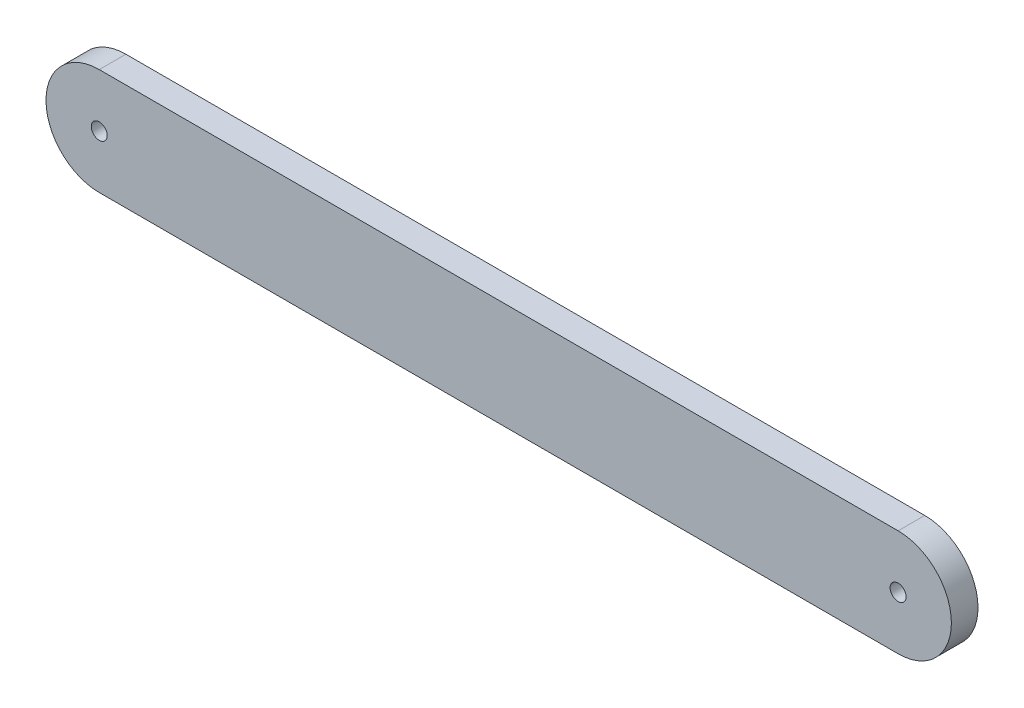
from build123d import *

# Parameters (mm, degrees)
BOSS_EXTRUDE1_DEPTH = 5
SKETCH4_R           = 1.5
CUT_EXTRUDE1_DEPTH  = 5


with BuildPart() as part:
    # Sketch2 → Boss-Extrude1 (new body)
    with BuildSketch(Plane.XY):
        with BuildLine():
            Line((-75, 10), (75, 10))
            ThreePointArc((75, 10), (85, 0), (75, -10))
            Line((75, -10), (-75, -10))
            ThreePointArc((-75, -10), (-85, 0), (-75, 10))
        make_face()
    extrude(amount=BOSS_EXTRUDE1_DEPTH)

    # Sketch4 → Cut-Extrude1 (cut)
    with BuildSketch(Plane(origin=(0, 0, 0), x_dir=(-1, 0, 0), z_dir=(0, 0, -1))):
        with Locations((-75, 0)):
            Circle(SKETCH4_R)
        with Locations((75, 0)):
            Circle(SKETCH4_R)
    extrude(amount=-CUT_EXTRUDE1_DEPTH, mode=Mode.SUBTRACT)


solid = part.part
